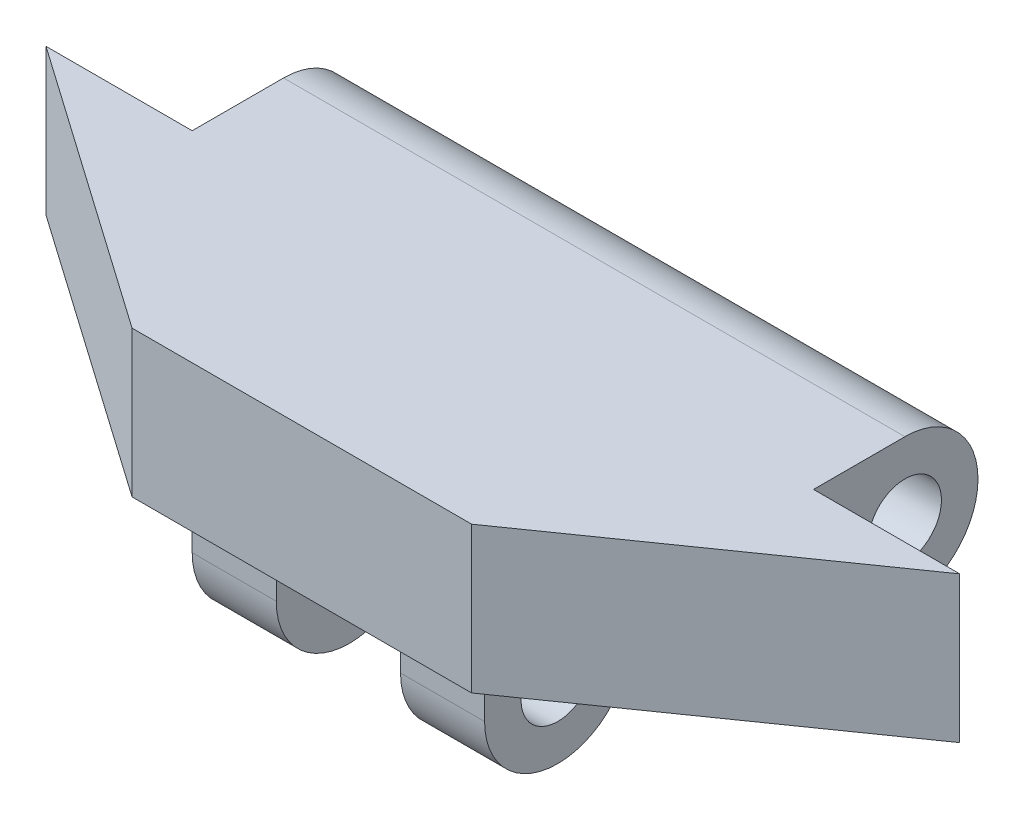
from build123d import *

# Parameters (mm, degrees)
BOSS_EXTRUDE1_DEPTH      = 4
BOSS_EXTRUDE2_START      = 4
SKETCH2_R                = 1
BOSS_EXTRUDE2_DEPTH      = 17
BOSS_EXTRUDE3_DEPTH      = 4
BOSS_EXTRUDE3_DEPTH_BACK = 4
BOSS_EXTRUDE3_START      = 12.5
SKETCH3_R                = 1
CUT_EXTRUDE1_REACH       = 29.221
SKETCH4_W                = 3.4
SKETCH4_H                = 3.5
CUT_EXTRUDE2_DEPTH       = 3.4


with BuildPart() as part:
    # Sketch1 → Boss-Extrude1 (new body)
    with BuildSketch(Plane(origin=(0, 0, 0), x_dir=(1, 0, 0), z_dir=(0, 1, 0))):
        Polygon((0, 0), (7.854814037, -5.5), (17.145185963, -5.5), (25, 0), align=None)
    extrude(amount=BOSS_EXTRUDE1_DEPTH)

    # Sketch2 → Boss-Extrude2 (add)
    with BuildSketch(Plane(origin=(0, 0, 0), x_dir=(0, 0, -1), z_dir=(1, 0, 0)).offset(BOSS_EXTRUDE2_START)):
        with BuildLine():
            Line((0, 0), (2.5, 0))
            ThreePointArc((2.5, 0), (4.5, 2), (2.5, 4))
            Line((2.5, 4), (0, 4))
            Line((0, 4), (0, 0))
        make_face()
        with Locations((2.5, 2)):
            Circle(SKETCH2_R, mode=Mode.SUBTRACT)
    extrude(amount=BOSS_EXTRUDE2_DEPTH)

    # Sketch3 → Boss-Extrude3 (add, two sides: drawn at the far end of the back side and taken through both)
    with BuildSketch(Plane(origin=(0, 0, 0), x_dir=(0, 0, -1), z_dir=(1, 0, 0)).offset(BOSS_EXTRUDE3_START - BOSS_EXTRUDE3_DEPTH_BACK)):
        with BuildLine():
            Line((-4.5, 0), (-0.5, 0))
            Line((-0.5, 0), (-0.5, -1.5))
            ThreePointArc((-0.5, -1.5), (-2.5, -3.5), (-4.5, -1.5))
            Line((-4.5, -1.5), (-4.5, 0))
        make_face()
        with Locations((-2.5, -1.5)):
            Circle(SKETCH3_R, mode=Mode.SUBTRACT)
    extrude(amount=BOSS_EXTRUDE3_DEPTH + BOSS_EXTRUDE3_DEPTH_BACK)

    # Sketch4 → Cut-Extrude1 (cut, up to next)
    with BuildSketch(Plane.XY.offset(5.5), mode=Mode.PRIVATE) as cut_extrude1_sk1:
        with Locations((12.5, -1.75)):
            Rectangle(SKETCH4_W, SKETCH4_H)
    cut_extrude1_tool1 = extrude(cut_extrude1_sk1.sketch, amount=-CUT_EXTRUDE1_REACH, mode=Mode.PRIVATE) & part.part
    add(cut_extrude1_tool1.solids().sort_by_distance((12.5, -1.75, 5.5))[0], mode=Mode.SUBTRACT)

    # Sketch5 → Cut-Extrude2 (cut)
    with BuildSketch(Plane.ZY.offset(-14.2)):
        with BuildLine():
            Line((4.5, 0), (0.5, 0))
            ThreePointArc((0.5, 0), (2.5, 1), (4.5, 0))
        make_face()
    extrude(amount=CUT_EXTRUDE2_DEPTH, mode=Mode.SUBTRACT)


solid = part.part
